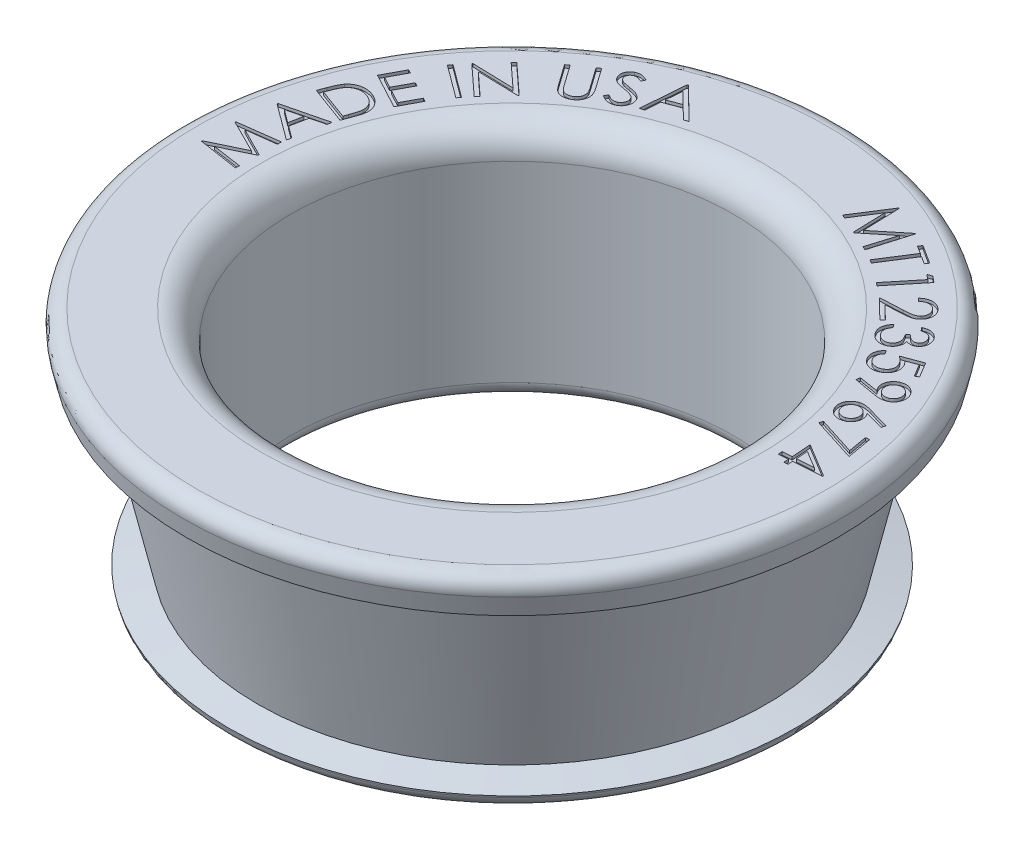
from build123d import *

# Parameters (mm, degrees)
CUT_EXTRUDE1_DEPTH = 0.2


with BuildPart() as part:
    # Sketch1 → Revolve1 (revolve)
    with BuildSketch(Plane.XY, mode=Mode.PRIVATE) as revolve1_sk:
        with BuildLine():
            Line((-15, 1), (-15, 14))
            ThreePointArc((-15, 14), (-15.585786438, 15.414213562), (-17, 16))
            Line((-17, 16), (-21.350008576, 16))
            ThreePointArc((-21.350008576, 16), (-22.130875294, 15.624697661), (-22.325619801, 14.780494335))
            Line((-22.325619801, 14.780494335), (-22.03526765, 13.49))
            Line((-22.03526765, 13.49), (-20.0840452, 13.92901133))
            Line((-20.0840452, 13.92901133), (-17.251383733, 1.33901133))
            Line((-17.251383733, 1.33901133), (-19.202606184, 0.9))
            Line((-19.202606184, 0.9), (-19.175718249, 0.780494335))
            ThreePointArc((-19.175718249, 0.780494335), (-18.824804685, 0.219133281), (-18.200107024, 0))
            Line((-18.200107024, 0), (-16, 0))
            ThreePointArc((-16, 0), (-15.292893219, 0.292893219), (-15, 1))
        make_face()
    revolve(revolve1_sk.sketch.rotate(Axis((0, 12.189542484, 0), (0, -1, 0)), 270), axis=Axis((0, 12.189542484, 0), (0, -1, 0)))

    # Sketch2 → Cut-Extrude1 (cut)
    # profile 1 of 19: a face of its own
    with BuildSketch(Plane(origin=(0, 16, 0), x_dir=(1, 0, 0), z_dir=(0, 1, 0))):
        Polygon((20.43086948, 0.684459038), (20.43472565, 0.628820016), (18.528675971, 0.495506714), (18.55181299, 0.164426987), (18.289593439, 0.1462479), (18.26645642, 0.477327628), (17.630739272, 0.432706234), (17.611458423, 0.705943413), (18.24717557, 0.750564807), (18.155729256, 2.057255512), align=None)
        Polygon((18.509395121, 0.768743894), (19.649168759, 0.848621698), (18.453205218, 1.573581634), align=None, mode=Mode.SUBTRACT)
    # profile 2 of 19: a face of its own
    with BuildSketch(Plane(origin=(0, 16, 0), x_dir=(1, 0, 0), z_dir=(0, 1, 0))):
        Polygon((19.866632365, 4.389117563), (20.163557446, 2.686343124), (17.160702878, 3.642673252), (17.23562275, 3.882857547), (19.836884769, 3.058738957), (19.612676035, 4.34504705), align=None)
    # profile 3 of 19: a face of its own
    with BuildSketch(Plane(origin=(0, 16, 0), x_dir=(1, 0, 0), z_dir=(0, 1, 0))):
        with BuildLine():
            Line((19.613202182, 5.734211606), (19.54213848, 5.474746462))
            Line((19.54213848, 5.474746462), (18.248668929, 5.835573785))
            add(Edge.make_bspline(
                [(18.248668929, 5.835573785), (18.263570366, 5.814895354), (18.292624338, 5.774577729), (18.32866575, 5.711118781), (18.359750467, 5.648742646), (18.374693, 5.605847669), (18.38198223, 5.584922744)],
                knots=[0, 0, 0, 0, 1.071951422, 2.090029772, 3.068282894, 4, 4, 4, 4], degree=3))
            add(Edge.make_bspline(
                [(18.38198223, 5.584922744), (18.389464761, 5.559339181), (18.404223048, 5.508879037), (18.417377424, 5.431878972), (18.422518818, 5.355620201), (18.419049881, 5.280094221), (18.407946789, 5.205352865), (18.389180761, 5.131071797), (18.361937108, 5.05771905), (18.327211748, 4.985940226), (18.286552719, 4.917048165), (18.239353341, 4.853289033), (18.186963618, 4.795341807), (18.129156403, 4.742909009), (18.065545548, 4.6968445), (17.996967165, 4.655737521), (17.922711385, 4.62080632), (17.870395274, 4.602601047), (17.843771092, 4.593336205)],
                knots=[0, 0, 0, 0, 1.017059747, 2.006013811, 2.975592457, 3.930021102, 4.886841578, 5.856090637, 6.849829531, 7.868965355, 8.897009229, 9.899612174, 10.892361288, 11.875207792, 12.873659358, 13.886068779, 14.924199685, 16, 16, 16, 16], degree=3))
            add(Edge.make_bspline(
                [(17.843771092, 4.593336205), (17.806717428, 4.582763755), (17.733848827, 4.561972298), (17.621961777, 4.548755719), (17.511437737, 4.548930149), (17.402721791, 4.564305459), (17.297704048, 4.594849431), (17.197722133, 4.639175203), (17.103626435, 4.697848622), (17.016764777, 4.769703973), (16.938842115, 4.852465262), (16.872326393, 4.944108446), (16.817105627, 5.043455997), (16.791368627, 5.114790447), (16.778366445, 5.150828192)],
                knots=[0, 0, 0, 0, 1.033318554, 2.032092631, 3.013380056, 3.99455597, 4.969915763, 5.941216094, 6.922305269, 7.938169325, 8.960273311, 9.966312265, 10.97259288, 12, 12, 12, 12], degree=3))
            add(Edge.make_bspline(
                [(16.778366445, 5.150828192), (16.768114542, 5.186412655), (16.747812576, 5.256880997), (16.736316196, 5.365906416), (16.736004003, 5.474743336), (16.752077265, 5.582635523), (16.780443877, 5.687917692), (16.825064135, 5.787104607), (16.881118599, 5.880916186), (16.952240187, 5.965499174), (17.03243215, 6.042087929), (17.122063962, 6.106591154), (17.218281638, 6.160984489), (17.287681654, 6.185636799), (17.322637278, 6.198053753)],
                knots=[0, 0, 0, 0, 1.012525083, 2.005115625, 2.990954643, 3.986789474, 4.983766827, 5.967872166, 6.956414768, 7.967489671, 8.985061678, 9.986090772, 10.985627698, 12, 12, 12, 12], degree=3))
            add(Edge.make_bspline(
                [(17.322637278, 6.198053753), (17.349859975, 6.205989988), (17.405337494, 6.222163351), (17.492821334, 6.235636229), (17.584700364, 6.24300876), (17.664456345, 6.242381671), (17.731648457, 6.237886113), (17.785895097, 6.232517684), (17.843400551, 6.224113732), (17.903959812, 6.21291902), (17.967867566, 6.199655053), (18.035162654, 6.184330357), (18.105607706, 6.165988679), (18.153570732, 6.152588711), (18.178156108, 6.145720019)],
                knots=[0, 0, 0, 0, 1.172219583, 2.388882806, 3.654047744, 4.983756441, 5.684276915, 6.440327581, 7.238718475, 8.088224331, 8.988283702, 9.939366117, 10.9437393, 12, 12, 12, 12], degree=3))
            Line((18.178156108, 6.145720019), (19.613202182, 5.734211606))
        make_face()
        with BuildLine():
            add(Edge.make_bspline(
                [(18.133534714, 5.573905115), (18.127107604, 5.592413442), (18.11445293, 5.628855458), (18.089385249, 5.680324322), (18.059912501, 5.728000262), (18.026580347, 5.772350082), (17.987715274, 5.811920316), (17.946208039, 5.849548898), (17.898750665, 5.881530539), (17.848616968, 5.910912044), (17.795660272, 5.934648158), (17.741750048, 5.953772025), (17.687320534, 5.967077709), (17.632084189, 5.974226569), (17.576538721, 5.975855737), (17.520239835, 5.971990838), (17.463560598, 5.962142713), (17.426296852, 5.951251686), (17.407473015, 5.945750067)],
                knots=[0, 0, 0, 0, 1.035921378, 2.039679938, 3.021138949, 3.998550293, 4.967425976, 5.951765989, 6.957028026, 7.988566464, 9.023393848, 10.022014201, 11.011709645, 11.981802356, 12.963501774, 13.947122328, 14.962985781, 16, 16, 16, 16], degree=3))
            add(Edge.make_bspline(
                [(17.407473015, 5.945750067), (17.388964281, 5.939323229), (17.352521464, 5.92666909), (17.301058427, 5.901597522), (17.253580189, 5.872274491), (17.209389369, 5.838994001), (17.169236176, 5.800676879), (17.132246536, 5.758460058), (17.099463366, 5.711404442), (17.07066079, 5.660897276), (17.046696801, 5.607896386), (17.027614419, 5.553959919), (17.014299573, 5.499537518), (17.007170569, 5.44448074), (17.00554348, 5.389125354), (17.00928798, 5.333354026), (17.019390876, 5.277090421), (17.030144661, 5.240167946), (17.035628063, 5.221341013)],
                knots=[0, 0, 0, 0, 1.037714762, 2.043211024, 3.026369134, 3.991834007, 4.969436824, 5.962802245, 6.961824933, 8.00359355, 9.040212423, 10.040561584, 11.031970384, 12.003742517, 12.977413451, 13.962736845, 14.961190506, 16, 16, 16, 16], degree=3))
            add(Edge.make_bspline(
                [(17.035628063, 5.221341013), (17.04205508, 5.202832495), (17.054709571, 5.166390103), (17.079778586, 5.114923975), (17.109110991, 5.067457085), (17.142357071, 5.023224613), (17.180708565, 4.983328777), (17.222428168, 4.945719871), (17.269855462, 4.913713791), (17.319992674, 4.884317257), (17.372966318, 4.860666205), (17.426767797, 4.841243187), (17.481430783, 4.829079347), (17.536276529, 4.820857979), (17.591749276, 4.819231975), (17.647378042, 4.824074139), (17.703804891, 4.833027582), (17.740672126, 4.843931544), (17.759486237, 4.849496061)],
                knots=[0, 0, 0, 0, 1.038341636, 2.044445311, 3.028197338, 3.99424544, 4.972438819, 5.959078579, 6.966689243, 8.0006377, 9.037882786, 10.038836249, 11.028594878, 12.002269794, 12.976528915, 13.963168675, 14.96056297, 16, 16, 16, 16], degree=3))
            add(Edge.make_bspline(
                [(17.759486237, 4.849496061), (17.777987623, 4.855941046), (17.814572325, 4.868685381), (17.866421025, 4.893663161), (17.914638594, 4.922920145), (17.958988315, 4.956686621), (17.999225745, 4.99490273), (18.036095604, 5.037224225), (18.068886268, 5.084057505), (18.098101802, 5.134449), (18.121880061, 5.187363492), (18.141053333, 5.241275198), (18.154131873, 5.295762914), (18.162123145, 5.350707308), (18.163812285, 5.406164923), (18.158952982, 5.461797797), (18.150004156, 5.518223539), (18.139099556, 5.555090927), (18.133534714, 5.573905115)],
                knots=[0, 0, 0, 0, 1.036259662, 2.049103211, 3.039169544, 4.016900064, 4.993132071, 5.97139377, 6.982557334, 8.014432625, 9.049597935, 10.04854439, 11.038563022, 12.010285626, 12.982591265, 13.967252717, 14.962647141, 16, 16, 16, 16], degree=3))
        make_face(mode=Mode.SUBTRACT)
    # profile 4 of 19: a face of its own
    with BuildSketch(Plane(origin=(0, 16, 0), x_dir=(1, 0, 0), z_dir=(0, 1, 0))):
        with BuildLine():
            Line((15.886447715, 7.438916574), (15.927763821, 7.704441414))
            Line((15.927763821, 7.704441414), (17.254837138, 7.484088849))
            add(Edge.make_bspline(
                [(17.254837138, 7.484088849), (17.2379649, 7.503463471), (17.205184856, 7.541105246), (17.162962006, 7.600697944), (17.125719634, 7.659468848), (17.10626522, 7.700375912), (17.096734173, 7.720416974)],
                knots=[0, 0, 0, 0, 1.079446535, 2.097191025, 3.067781697, 4, 4, 4, 4], degree=3))
            add(Edge.make_bspline(
                [(17.096734173, 7.720416974), (17.086463151, 7.745198073), (17.066255583, 7.793953274), (17.04559552, 7.869460064), (17.032152445, 7.944689161), (17.026461979, 8.020200997), (17.029258947, 8.095948685), (17.040511351, 8.171775451), (17.059506719, 8.247718951), (17.085668927, 8.32302489), (17.118942424, 8.3960704), (17.159469483, 8.464419082), (17.205298655, 8.52826153), (17.257225284, 8.586908361), (17.315545009, 8.640078102), (17.379762616, 8.687853116), (17.449395386, 8.731659786), (17.499697796, 8.755134524), (17.52531991, 8.767091654)],
                knots=[0, 0, 0, 0, 1.020953732, 2.008660133, 2.974629625, 3.928468592, 4.887372089, 5.855794922, 6.843129749, 7.865113259, 8.888579743, 9.895054551, 10.887061043, 11.878031291, 12.873164625, 13.887387248, 14.923916253, 16, 16, 16, 16], degree=3))
            add(Edge.make_bspline(
                [(17.52531991, 8.767091654), (17.561168874, 8.781630853), (17.631519142, 8.810162683), (17.741148737, 8.83611936), (17.850848537, 8.8465514), (17.96019228, 8.842894308), (18.067698778, 8.824096718), (18.171983979, 8.79077714), (18.27183455, 8.742105946), (18.366332438, 8.680011517), (18.453817993, 8.607049152), (18.529556172, 8.522738116), (18.595313437, 8.430512197), (18.628538309, 8.362715199), (18.645261817, 8.328590051)],
                knots=[0, 0, 0, 0, 1.038237026, 2.037443937, 3.013882615, 3.991355268, 4.967931042, 5.936849831, 6.923197063, 7.942661205, 8.968539792, 9.97444765, 10.980452295, 12, 12, 12, 12], degree=3))
            add(Edge.make_bspline(
                [(18.645261817, 8.328590051), (18.659272735, 8.294024304), (18.687040248, 8.225520235), (18.711321953, 8.117780643), (18.722107379, 8.008578463), (18.718131076, 7.89892078), (18.700250537, 7.790795659), (18.667243342, 7.686934592), (18.620720765, 7.587644687), (18.559350041, 7.49549787), (18.487838633, 7.410663638), (18.405961598, 7.337117783), (18.316240678, 7.27351263), (18.250414062, 7.241376377), (18.217226962, 7.225174587)],
                knots=[0, 0, 0, 0, 1.017701609, 2.016930239, 3.004960264, 4.00906468, 5.006326224, 5.990181482, 6.977740019, 7.992233138, 9.006664218, 10.001309583, 10.992341663, 12, 12, 12, 12], degree=3))
            add(Edge.make_bspline(
                [(18.217226962, 7.225174587), (18.190784352, 7.214377042), (18.136931834, 7.192386967), (18.051028079, 7.168530297), (17.959977583, 7.15152536), (17.880251156, 7.143423002), (17.812904279, 7.140431258), (17.758330475, 7.140711508), (17.700269852, 7.142220771), (17.638724827, 7.146175809), (17.573520361, 7.152316221), (17.504818829, 7.160568515), (17.432683486, 7.171170941), (17.383548733, 7.179199031), (17.358402843, 7.183307599)],
                knots=[0, 0, 0, 0, 1.177368547, 2.397806446, 3.669468466, 4.994467892, 5.699549295, 6.449426534, 7.245075434, 8.095076712, 8.992744928, 9.946352323, 10.948996452, 12, 12, 12, 12], degree=3))
            Line((17.358402843, 7.183307599), (15.886447715, 7.438916574))
        make_face()
        with BuildLine():
            add(Edge.make_bspline(
                [(17.342427282, 7.760080436), (17.350885219, 7.742261162), (17.367520756, 7.70721323), (17.398325291, 7.658519237), (17.432365933, 7.613669838), (17.470600482, 7.573226524), (17.512912832, 7.537072927), (17.559136485, 7.505270373), (17.609315656, 7.477416751), (17.662671665, 7.454182869), (17.717865898, 7.435293227), (17.773678239, 7.422794617), (17.829353464, 7.415218545), (17.884946159, 7.414366613), (17.940322778, 7.418662835), (17.99540531, 7.428946124), (18.050633567, 7.443918474), (18.086264157, 7.458885868), (18.104296272, 7.466460644)],
                knots=[0, 0, 0, 0, 1.041528426, 2.048535627, 3.038377746, 4.013121523, 4.983556857, 5.974112206, 6.973186582, 8.01168184, 9.045815563, 10.050997669, 11.0295499, 12.009832722, 12.983319824, 13.959752723, 14.967461003, 16, 16, 16, 16], degree=3))
            add(Edge.make_bspline(
                [(18.104296272, 7.466460644), (18.121884258, 7.474997836), (18.156533026, 7.491816314), (18.205430727, 7.521533185), (18.249625195, 7.556074827), (18.290037199, 7.594072753), (18.326264661, 7.636231947), (18.357369723, 7.682800614), (18.385344727, 7.732772614), (18.408532648, 7.786160919), (18.427427178, 7.841347177), (18.439991313, 7.897337025), (18.447464362, 7.953206577), (18.448390118, 8.008984351), (18.443954645, 8.064515152), (18.434038386, 8.119925534), (18.417984887, 8.175262321), (18.403211545, 8.211192896), (18.395712538, 8.229431398)],
                knots=[0, 0, 0, 0, 1.032605273, 2.034257941, 3.016171675, 3.990676813, 4.960874564, 5.945707462, 6.944537243, 7.982778255, 9.016658799, 10.021594814, 11.009528805, 11.989571632, 12.962820403, 13.948560784, 14.95868137, 16, 16, 16, 16], degree=3))
            add(Edge.make_bspline(
                [(18.395712538, 8.229431398), (18.387221573, 8.24704806), (18.370452158, 8.281840467), (18.340006839, 8.330401523), (18.305584785, 8.374783448), (18.267539648, 8.415166227), (18.225393005, 8.45140127), (18.178821115, 8.482505103), (18.128849263, 8.510477236), (18.075463781, 8.533678409), (18.020435782, 8.552465277), (17.964669686, 8.565195931), (17.909144751, 8.572571533), (17.853562998, 8.573499822), (17.798367438, 8.569190584), (17.743285527, 8.558914661), (17.6880571, 8.5439403), (17.652426533, 8.528973182), (17.634394429, 8.521398545)],
                knots=[0, 0, 0, 0, 1.034887623, 2.043873513, 3.027957555, 4.004616624, 4.976958787, 5.963968446, 6.965005923, 8.005541742, 9.041707455, 10.039386768, 11.029504373, 12.001992362, 12.977392288, 13.9557438, 14.965432147, 16, 16, 16, 16], degree=3))
            add(Edge.make_bspline(
                [(17.634394429, 8.521398545), (17.616806682, 8.51286119), (17.582158383, 8.49604239), (17.533257267, 8.466327862), (17.48907542, 8.431777566), (17.448616847, 8.393811565), (17.412495641, 8.351454211), (17.380684229, 8.305242856), (17.352833057, 8.255060318), (17.329598412, 8.201705224), (17.310709277, 8.146510831), (17.298209448, 8.090698222), (17.290637624, 8.035024187), (17.289769979, 7.979427017), (17.294124529, 7.924067032), (17.304196538, 7.868872069), (17.32004577, 7.813841024), (17.334912995, 7.77812982), (17.342427282, 7.760080436)],
                knots=[0, 0, 0, 0, 1.03407368, 2.037150739, 3.020460795, 3.996351719, 4.967929131, 5.959650235, 6.959900392, 7.999617825, 9.03496859, 10.041333666, 11.021037526, 12.002474014, 12.977106785, 13.954688819, 14.966245838, 16, 16, 16, 16], degree=3))
        make_face(mode=Mode.SUBTRACT)
    # profile 5 of 19: a face of its own
    with BuildSketch(Plane(origin=(0, 16, 0), x_dir=(1, 0, 0), z_dir=(0, 1, 0))):
        with BuildLine():
            Line((17.883266149, 9.751450901), (17.659057415, 9.617586719))
            Line((17.659057415, 9.617586719), (17.15720445, 10.456579106))
            Line((17.15720445, 10.456579106), (16.445465668, 10.188850741))
            add(Edge.make_bspline(
                [(16.445465668, 10.188850741), (16.467220404, 10.167999014), (16.509161399, 10.127798932), (16.565714991, 10.06509552), (16.614685353, 10.003079632), (16.642091942, 9.960096884), (16.655351485, 9.939301462)],
                knots=[0, 0, 0, 0, 1.105223162, 2.130761699, 3.095646451, 4, 4, 4, 4], degree=3))
            add(Edge.make_bspline(
                [(16.655351485, 9.939301462), (16.670297009, 9.912538322), (16.699600977, 9.860063335), (16.735416735, 9.778612472), (16.76096332, 9.696247022), (16.779327711, 9.613575043), (16.787311179, 9.530186654), (16.786833677, 9.446370796), (16.777290063, 9.362198703), (16.759188648, 9.27842058), (16.732791756, 9.196496492), (16.698671741, 9.117940032), (16.656444006, 9.043934822), (16.607277773, 8.973798716), (16.549371174, 8.908691629), (16.484204923, 8.847622742), (16.41173645, 8.790105204), (16.358593023, 8.756967957), (16.331433216, 8.740032632)],
                knots=[0, 0, 0, 0, 1.056230551, 2.0709709, 3.059819983, 4.024368298, 4.984775428, 5.940499657, 6.908530257, 7.899160177, 8.889931616, 9.870604386, 10.845623872, 11.821977694, 12.817488488, 13.842832062, 14.897544494, 16, 16, 16, 16], degree=3))
            add(Edge.make_bspline(
                [(16.331433216, 8.740032632), (16.312091876, 8.728968436), (16.273783425, 8.707054121), (16.214513695, 8.678423526), (16.154501664, 8.653363317), (16.093244768, 8.63324075), (16.031536251, 8.616431834), (15.968895766, 8.604409715), (15.905430641, 8.596153151), (15.841409326, 8.591627981), (15.777733795, 8.591751596), (15.715190315, 8.595614173), (15.654012014, 8.603081342), (15.594439066, 8.615425616), (15.536172213, 8.631299261), (15.479414806, 8.651919224), (15.423786534, 8.676077979), (15.369527458, 8.704194125), (15.317538335, 8.736611404), (15.267558565, 8.772784417), (15.219561738, 8.812372917), (15.17397061, 8.85604166), (15.130180803, 8.902972351), (15.088896458, 8.953845368), (15.049574756, 9.008401615), (15.025789381, 9.047084464), (15.013724883, 9.066705308)],
                knots=[0, 0, 0, 0, 1.054064986, 2.087735186, 3.11234581, 4.128967723, 5.136414227, 6.136678694, 7.144349983, 8.163308407, 9.17120443, 10.154916219, 11.127009337, 12.08466666, 13.031143332, 13.982076284, 14.93929993, 15.89920135, 16.870867234, 17.835476005, 18.816690425, 19.812302386, 20.820572856, 21.851903273, 22.910435187, 24, 24, 24, 24], degree=3))
            add(Edge.make_bspline(
                [(15.013724883, 9.066705308), (15.000300916, 9.090373194), (14.973773738, 9.13714344), (14.94129195, 9.209719296), (14.916530163, 9.283042073), (14.897775595, 9.356440678), (14.887746393, 9.430717139), (14.883349017, 9.505206289), (14.887805186, 9.580244678), (14.897875885, 9.65535616), (14.915599693, 9.729229541), (14.939291311, 9.800592796), (14.969127229, 9.868963732), (15.00589969, 9.933860116), (15.047631351, 9.996616916), (15.096485241, 10.055713727), (15.15175383, 10.111405284), (15.192132554, 10.145621456), (15.212593072, 10.162959315)],
                knots=[0, 0, 0, 0, 1.067413164, 2.109321305, 3.114291042, 4.101772644, 5.077057584, 6.051197089, 7.025336594, 8.022030563, 9.021819742, 10.001699534, 10.969716098, 11.944015512, 12.925351587, 13.923685392, 14.947899562, 16, 16, 16, 16], degree=3))
            Line((15.212593072, 10.162959315), (15.357474883, 9.921122376))
            add(Edge.make_bspline(
                [(15.357474883, 9.921122376), (15.338485968, 9.903366158), (15.301944736, 9.869197062), (15.256042303, 9.812782499), (15.218456533, 9.75603419), (15.190526496, 9.697343594), (15.171136564, 9.636892932), (15.158729753, 9.574223297), (15.154865983, 9.50855393), (15.156775207, 9.440987165), (15.166479027, 9.373055723), (15.184577048, 9.307327835), (15.208441082, 9.243533105), (15.230608882, 9.20398843), (15.241789787, 9.184043049)],
                knots=[0, 0, 0, 0, 1.148740579, 2.210573737, 3.208606875, 4.15321981, 5.075355568, 6.01042175, 6.971067052, 7.978770579, 8.99650644, 9.997410958, 10.989942328, 12, 12, 12, 12], degree=3))
            add(Edge.make_bspline(
                [(15.241789787, 9.184043049), (15.253684949, 9.165205895), (15.277153502, 9.128041146), (15.31899254, 9.07799559), (15.364287715, 9.032591303), (15.414868215, 8.993703415), (15.468928027, 8.959295143), (15.527388759, 8.930257693), (15.590381008, 8.907585034), (15.656565711, 8.889145454), (15.724905119, 8.877881528), (15.793503549, 8.872803205), (15.861799888, 8.874365772), (15.929778783, 8.883154359), (15.997263186, 8.899673431), (16.064744604, 8.921505213), (16.13178909, 8.95076717), (16.174650117, 8.9753938), (16.196467271, 8.987929267)],
                knots=[0, 0, 0, 0, 0.983962148, 1.941307442, 2.87703253, 3.814059754, 4.75550777, 5.706740854, 6.693044578, 7.711241678, 8.740255896, 9.749578728, 10.74843211, 11.755401444, 12.773436706, 13.815751248, 14.888172002, 16, 16, 16, 16], degree=3))
            add(Edge.make_bspline(
                [(16.196467271, 8.987929267), (16.215608733, 9.000089177), (16.253086209, 9.023897323), (16.304372508, 9.064455808), (16.350643801, 9.107277435), (16.390453044, 9.154187134), (16.425338803, 9.203571475), (16.45422148, 9.256228732), (16.476765483, 9.31201196), (16.494436451, 9.370028436), (16.506048998, 9.430019469), (16.511026215, 9.490795004), (16.509327967, 9.551929676), (16.500975988, 9.6134179), (16.485835931, 9.675119057), (16.464883384, 9.737419129), (16.436492038, 9.799688835), (16.413635317, 9.840304714), (16.401946037, 9.861076302)],
                knots=[0, 0, 0, 0, 1.076867555, 2.108421845, 3.102200765, 4.067496262, 5.02602517, 5.970956099, 6.913951519, 7.880035334, 8.848558858, 9.811525056, 10.771641065, 11.74892827, 12.754132062, 13.786055278, 14.86775447, 16, 16, 16, 16], degree=3))
            add(Edge.make_bspline(
                [(16.401946037, 9.861076302), (16.390791899, 9.878678077), (16.367976409, 9.914682035), (16.328190452, 9.967340787), (16.283219134, 10.020566165), (16.232351522, 10.07397918), (16.175879526, 10.127633325), (16.113545117, 10.181187193), (16.046280752, 10.236199814), (15.998491586, 10.271503535), (15.973911181, 10.289662039)],
                knots=[0, 0, 0, 0, 0.82011155, 1.6775162, 2.595760191, 3.562254399, 4.579851, 5.661191924, 6.797031754, 8, 8, 8, 8], degree=3))
            Line((15.973911181, 10.289662039), (17.272889546, 10.771683273))
            Line((17.272889546, 10.771683273), (17.883266149, 9.751450901))
        make_face()
    # profile 6 of 19: a face of its own
    with BuildSketch(Plane(origin=(0, 16, 0), x_dir=(1, 0, 0), z_dir=(0, 1, 0))):
        with BuildLine():
            Line((15.22922776, 12.504583298), (15.059556286, 12.724384981))
            add(Edge.make_bspline(
                [(15.059556286, 12.724384981), (15.085316396, 12.735721759), (15.135694487, 12.757892675), (15.212148766, 12.78516647), (15.287492617, 12.805597277), (15.361753776, 12.819391141), (15.434685573, 12.827438826), (15.506586614, 12.828351961), (15.577408274, 12.823612267), (15.646746987, 12.812006298), (15.71386732, 12.79415971), (15.778555981, 12.771818948), (15.839981831, 12.74357541), (15.898206218, 12.709720089), (15.953298064, 12.670363577), (16.005909291, 12.626277627), (16.05526647, 12.576409906), (16.085047653, 12.539734442), (16.10017127, 12.521109741)],
                knots=[0, 0, 0, 0, 1.170621759, 2.289341555, 3.37343437, 4.414775063, 5.428829454, 6.422066798, 7.402322022, 8.37816166, 9.341693541, 10.288792222, 11.22198596, 12.149660019, 13.086567386, 14.035359102, 15.002307077, 16, 16, 16, 16], degree=3))
            add(Edge.make_bspline(
                [(16.10017127, 12.521109741), (16.120758716, 12.492765085), (16.161448253, 12.436744008), (16.208951963, 12.344668246), (16.24437305, 12.248185461), (16.267783227, 12.14845672), (16.27972045, 12.048059937), (16.278210395, 11.949276415), (16.263284569, 11.853366869), (16.235034417, 11.762086614), (16.196613165, 11.676513151), (16.148613212, 11.598818405), (16.090811611, 11.529707174), (16.04532077, 11.491434032), (16.022496991, 11.472231535)],
                knots=[0, 0, 0, 0, 1.079583299, 2.133715055, 3.184049225, 4.243526234, 5.28708527, 6.295656947, 7.28202626, 8.271271126, 9.23479344, 10.168610749, 11.081150791, 12, 12, 12, 12], degree=3))
            add(Edge.make_bspline(
                [(16.022496991, 11.472231535), (15.999246351, 11.455549799), (15.953675064, 11.422853573), (15.878608853, 11.386429365), (15.800875561, 11.360540618), (15.719708245, 11.346835013), (15.635516989, 11.344705156), (15.548636279, 11.354673583), (15.458482561, 11.374952321), (15.399225238, 11.396957108), (15.368600757, 11.408329292)],
                knots=[0, 0, 0, 0, 0.993167429, 1.946609529, 2.887231222, 3.83271326, 4.796884882, 5.804874094, 6.865547965, 8, 8, 8, 8], degree=3))
            add(Edge.make_bspline(
                [(15.368600757, 11.408329292), (15.376832613, 11.374882813), (15.393097326, 11.3087984), (15.401821452, 11.208001725), (15.399403388, 11.10827555), (15.386950899, 11.043536665), (15.380720148, 11.011143795)],
                knots=[0, 0, 0, 0, 1.028424054, 2.031986648, 3.01528113, 4, 4, 4, 4], degree=3))
            add(Edge.make_bspline(
                [(15.380720148, 11.011143795), (15.375028569, 10.988816027), (15.363839214, 10.944920771), (15.340863629, 10.881553139), (15.313498482, 10.821618781), (15.281291967, 10.765110856), (15.244831134, 10.711868883), (15.20346234, 10.662133196), (15.156810032, 10.616214989), (15.122943029, 10.588366459), (15.105830324, 10.574294837)],
                knots=[0, 0, 0, 0, 1.04933343, 2.062936215, 3.066265967, 4.047979045, 5.022679286, 6.00285813, 6.990861457, 8, 8, 8, 8], degree=3))
            add(Edge.make_bspline(
                [(15.105830324, 10.574294837), (15.074659271, 10.552012445), (15.01270031, 10.50772155), (14.908663032, 10.458504368), (14.798661442, 10.420931132), (14.68239529, 10.398971321), (14.56412891, 10.390864531), (14.44657703, 10.39919003), (14.331637303, 10.423662877), (14.220316244, 10.464033249), (14.114247058, 10.519369929), (14.015066214, 10.58881659), (13.923042641, 10.672009882), (13.869797304, 10.736458647), (13.842659251, 10.769306856)],
                knots=[0, 0, 0, 0, 0.967326136, 1.922762143, 2.897916062, 3.900711948, 4.905945992, 5.888327616, 6.871137262, 7.868628225, 8.873990995, 9.887919833, 10.923516197, 12, 12, 12, 12], degree=3))
            add(Edge.make_bspline(
                [(13.842659251, 10.769306856), (13.825498102, 10.792325526), (13.791835271, 10.837478308), (13.749884083, 10.909183896), (13.713120189, 10.9808384), (13.685561062, 11.054438167), (13.663328018, 11.128454435), (13.650028554, 11.203708563), (13.642386963, 11.279784616), (13.643042298, 11.356783783), (13.651599783, 11.434182531), (13.666649565, 11.511477138), (13.690948867, 11.58829641), (13.722909221, 11.664493635), (13.762459354, 11.740506618), (13.809389705, 11.816149878), (13.864609464, 11.891191702), (13.906216547, 11.939111104), (13.927494988, 11.963617753)],
                knots=[0, 0, 0, 0, 1.046164699, 2.052127569, 3.025355424, 3.979155154, 4.913650632, 5.839566384, 6.761040685, 7.698506168, 8.641313105, 9.597319676, 10.565188662, 11.573711097, 12.606938389, 13.686513166, 14.816850631, 16, 16, 16, 16], degree=3))
            Line((13.927494988, 11.963617753), (14.090555885, 11.752630173))
            add(Edge.make_bspline(
                [(14.090555885, 11.752630173), (14.077354663, 11.734936649), (14.051634959, 11.700464674), (14.016825188, 11.648197864), (13.987139037, 11.597002182), (13.961785263, 11.547165278), (13.942381987, 11.49829054), (13.926304085, 11.451034929), (13.915808137, 11.404837476), (13.912182969, 11.374213463), (13.910417664, 11.359300846)],
                knots=[0, 0, 0, 0, 1.208536834, 2.354570562, 3.435752511, 4.447386667, 5.412594331, 6.312330366, 7.178175274, 8, 8, 8, 8], degree=3))
            add(Edge.make_bspline(
                [(13.910417664, 11.359300846), (13.909666369, 11.340751468), (13.908161573, 11.303598261), (13.912829026, 11.248023263), (13.922821715, 11.192866259), (13.938401362, 11.138555605), (13.958671773, 11.084455608), (13.985839018, 11.031702869), (14.016660408, 10.978357503), (14.04189108, 10.944973262), (14.054748594, 10.927960702)],
                knots=[0, 0, 0, 0, 0.956791072, 1.916390735, 2.869424145, 3.843866249, 4.827151895, 5.843720866, 6.901163341, 8, 8, 8, 8], degree=3))
            add(Edge.make_bspline(
                [(14.054748594, 10.927960702), (14.069834881, 10.9091172), (14.099294747, 10.872320401), (14.148297555, 10.823220082), (14.198847896, 10.779834202), (14.252071137, 10.743489195), (14.307035439, 10.712663544), (14.364296975, 10.688429945), (14.423986821, 10.670635335), (14.485135703, 10.65926454), (14.546374849, 10.653955521), (14.60635043, 10.653546073), (14.664205407, 10.659990634), (14.720473885, 10.670635658), (14.774378625, 10.688091102), (14.82678632, 10.710131037), (14.877073584, 10.738211452), (14.908288425, 10.76107512), (14.924039459, 10.772612144)],
                knots=[0, 0, 0, 0, 1.174255564, 2.293036807, 3.371192855, 4.412555279, 5.424893408, 6.434306956, 7.432616995, 8.45121062, 9.456340586, 10.421732668, 11.36544471, 12.28579551, 13.204582269, 14.117742549, 15.05021141, 16, 16, 16, 16], degree=3))
            add(Edge.make_bspline(
                [(14.924039459, 10.772612144), (14.944046245, 10.789494375), (14.984010879, 10.823217539), (15.034119842, 10.883778609), (15.07487553, 10.951745259), (15.106305098, 11.025559097), (15.128813937, 11.103370005), (15.13843479, 11.18347149), (15.137458522, 11.264097572), (15.126837978, 11.331989027), (15.111356512, 11.387608936), (15.09608324, 11.433086857), (15.075038405, 11.481126984), (15.050650288, 11.532608253), (15.020931025, 11.587043281), (14.986823617, 11.644356586), (14.948966887, 11.705332074), (14.920913275, 11.745954007), (14.906411254, 11.76695309)],
                knots=[0, 0, 0, 0, 1.124437763, 2.246125028, 3.362458679, 4.523162054, 5.688560254, 6.834954948, 7.980505594, 9.148070436, 9.778555351, 10.463045364, 11.209881218, 12.03314667, 12.913269653, 13.87653484, 14.902296939, 16, 16, 16, 16], degree=3))
            Line((14.906411254, 11.76695309), (15.103626799, 11.918996359))
            add(Edge.make_bspline(
                [(15.103626799, 11.918996359), (15.123076069, 11.895525279), (15.161255081, 11.849451434), (15.224156426, 11.787123393), (15.291966532, 11.73441106), (15.361548881, 11.688932711), (15.432752927, 11.654863964), (15.501602488, 11.629629646), (15.568164983, 11.61680468), (15.631672911, 11.61394761), (15.691835417, 11.623127205), (15.748979922, 11.638425488), (15.802278773, 11.663933653), (15.834382026, 11.68625195), (15.850621991, 11.697542032)],
                knots=[0, 0, 0, 0, 1.265161036, 2.483517262, 3.667028433, 4.825925916, 5.927248791, 6.937521129, 7.861527016, 8.731159728, 9.562419002, 10.378186849, 11.179578806, 12, 12, 12, 12], degree=3))
            add(Edge.make_bspline(
                [(15.850621991, 11.697542032), (15.861833808, 11.706873878), (15.883933516, 11.725267961), (15.913453397, 11.756401569), (15.93860161, 11.790338008), (15.961301981, 11.825941705), (15.97798778, 11.865264183), (15.992033482, 11.906619411), (16.001730666, 11.950781193), (16.007875557, 11.996849478), (16.009403413, 12.043884022), (16.006880758, 12.090976114), (15.998881977, 12.137416623), (15.986864406, 12.183441279), (15.969668959, 12.22858709), (15.947715664, 12.272961957), (15.922232259, 12.317263768), (15.901420547, 12.34502969), (15.890836334, 12.359150606)],
                knots=[0, 0, 0, 0, 0.948564574, 1.869723848, 2.782477639, 3.694292705, 4.608921057, 5.553414197, 6.533068051, 7.545184008, 8.573250798, 9.590501041, 10.607891585, 11.633734624, 12.68105785, 13.744340692, 14.852839302, 16, 16, 16, 16], degree=3))
            add(Edge.make_bspline(
                [(15.890836334, 12.359150606), (15.872583643, 12.380901092), (15.83693664, 12.423379191), (15.773070564, 12.475452789), (15.702761863, 12.514223708), (15.639684828, 12.536857565), (15.586119804, 12.547686876), (15.543000673, 12.552772354), (15.497123828, 12.553465506), (15.448462818, 12.551632728), (15.397449167, 12.544340485), (15.343497801, 12.535180133), (15.286999327, 12.522006978), (15.248815575, 12.510490907), (15.22922776, 12.504583298)],
                knots=[0, 0, 0, 0, 1.399838653, 2.733846269, 4.040800811, 5.348510018, 6.024254412, 6.736198773, 7.489005781, 8.287754867, 9.138007628, 10.030944185, 10.989897596, 12, 12, 12, 12], degree=3))
        make_face()
    # profile 7 of 19: a face of its own
    with BuildSketch(Plane(origin=(0, 16, 0), x_dir=(1, 0, 0), z_dir=(0, 1, 0))):
        with BuildLine():
            Line((13.409611884, 14.157364559), (13.222863086, 14.340257188))
            add(Edge.make_bspline(
                [(13.222863086, 14.340257188), (13.24705242, 14.362788738), (13.294586896, 14.407065502), (13.371773881, 14.463858757), (13.450067436, 14.514062758), (13.531999506, 14.55326245), (13.615753989, 14.585125539), (13.701849911, 14.608588249), (13.79056925, 14.621999306), (13.880555456, 14.627681505), (13.970217397, 14.624319232), (14.05784789, 14.612764935), (14.142673509, 14.59300194), (14.224410459, 14.564176786), (14.303130136, 14.526910545), (14.378962147, 14.48161843), (14.45154027, 14.427318586), (14.496318169, 14.385672411), (14.519087044, 14.36449597)],
                knots=[0, 0, 0, 0, 1.097684638, 2.157060765, 3.17973517, 4.184093402, 5.169020387, 6.154892147, 7.143121891, 8.145773102, 9.147235104, 10.119892229, 11.079055637, 12.036334196, 12.994487631, 13.968827886, 14.967180126, 16, 16, 16, 16], degree=3))
            add(Edge.make_bspline(
                [(14.519087044, 14.36449597), (14.540636504, 14.34248269), (14.582782103, 14.299429969), (14.637457489, 14.229558731), (14.683542991, 14.157589928), (14.721230346, 14.083419261), (14.750871268, 14.006936839), (14.771199215, 13.927971929), (14.782796962, 13.846680538), (14.785857456, 13.764188193), (14.781523862, 13.682139537), (14.769943124, 13.602280511), (14.751366794, 13.525643189), (14.725208549, 13.452214305), (14.691808877, 13.382133745), (14.652399809, 13.314471092), (14.604480447, 13.250874084), (14.568272191, 13.211571962), (14.549936403, 13.191669447)],
                knots=[0, 0, 0, 0, 1.127792723, 2.205693365, 3.24320908, 4.25401682, 5.248419127, 6.242024792, 7.234240495, 8.250784342, 9.261233894, 10.240134976, 11.202721451, 12.145261741, 13.090103602, 14.043028417, 15.008993551, 16, 16, 16, 16], degree=3))
            add(Edge.make_bspline(
                [(14.549936403, 13.191669447), (14.522315865, 13.165359106), (14.467437858, 13.113084272), (14.373685815, 13.048812139), (14.273329559, 12.995724005), (14.182664751, 12.962466428), (14.103848985, 12.941779725), (14.036676514, 12.926596184), (13.961562535, 12.91398224), (13.878603041, 12.901549572), (13.78796575, 12.891555463), (13.689383884, 12.881901403), (13.583002993, 12.874510192), (13.509326292, 12.870415063), (13.471310602, 12.868302059)],
                knots=[0, 0, 0, 0, 1.186743773, 2.357887887, 3.527256321, 4.716369176, 5.356071332, 6.065278146, 6.86092497, 7.728183885, 8.678307981, 9.701194984, 10.813863032, 12, 12, 12, 12], degree=3))
            Line((13.471310602, 12.868302059), (12.47421525, 12.819824495))
            Line((12.47421525, 12.819824495), (13.374355474, 11.938414239))
            Line((13.374355474, 11.938414239), (13.189810201, 11.750012797))
            Line((13.189810201, 11.750012797), (11.865491291, 13.046787636))
            Line((11.865491291, 13.046787636), (13.398594256, 13.12225839))
            add(Edge.make_bspline(
                [(13.398594256, 13.12225839), (13.435877832, 13.123963544), (13.507535339, 13.127240781), (13.610353087, 13.13403561), (13.70441293, 13.140975636), (13.789642302, 13.149180454), (13.866273774, 13.158348085), (13.934018362, 13.168907885), (13.993121139, 13.179557899), (14.059516511, 13.195461285), (14.134111671, 13.220713101), (14.215458216, 13.26204972), (14.290664608, 13.312190457), (14.334166738, 13.353335966), (14.356026147, 13.374011194)],
                knots=[0, 0, 0, 0, 1.323243412, 2.54321964, 3.653243836, 4.667092822, 5.578801727, 6.389096633, 7.097789806, 7.707317384, 8.808831704, 9.880306154, 10.934873908, 12, 12, 12, 12], degree=3))
            add(Edge.make_bspline(
                [(14.356026147, 13.374011194), (14.368760367, 13.387937642), (14.393816688, 13.415339837), (14.426763806, 13.459714801), (14.453817576, 13.506977671), (14.475897064, 13.556417706), (14.492509088, 13.60835226), (14.504207081, 13.662392023), (14.509970842, 13.718895118), (14.511256018, 13.776784789), (14.506674065, 13.834842192), (14.497581356, 13.89173241), (14.482531508, 13.946733571), (14.462035466, 13.999602368), (14.436669958, 14.050682391), (14.405543803, 14.099330993), (14.368982856, 14.145998498), (14.341061891, 14.174690297), (14.326829432, 14.189315681)],
                knots=[0, 0, 0, 0, 0.99823837, 1.964170784, 2.917557768, 3.874602325, 4.824168502, 5.798083963, 6.794997154, 7.825215894, 8.858180669, 9.872605081, 10.86975504, 11.869505751, 12.869020309, 13.882606623, 14.920677893, 16, 16, 16, 16], degree=3))
            add(Edge.make_bspline(
                [(14.326829432, 14.189315681), (14.311324623, 14.203973595), (14.280836183, 14.232796712), (14.230936086, 14.269591487), (14.179326832, 14.300851759), (14.125725928, 14.32609599), (14.070573216, 14.346404608), (14.013137303, 14.359404719), (13.954118962, 14.367110367), (13.893433176, 14.369342923), (13.831939084, 14.365608566), (13.770435422, 14.355064262), (13.709481566, 14.337645614), (13.648733867, 14.314282735), (13.587733178, 14.285254011), (13.527854567, 14.248211751), (13.46757328, 14.206065267), (13.429207026, 14.17382892), (13.409611884, 14.157364559)],
                knots=[0, 0, 0, 0, 1.002295113, 1.970899169, 2.908062872, 3.834831094, 4.752345746, 5.665341296, 6.596921847, 7.547155263, 8.515913188, 9.488088395, 10.474683329, 11.491154209, 12.545237488, 13.645265037, 14.797345008, 16, 16, 16, 16], degree=3))
        make_face()
    # profile 8 of 19: a face of its own
    with BuildSketch(Plane(origin=(0, 16, 0), x_dir=(1, 0, 0), z_dir=(0, 1, 0))):
        Polygon((12.409915094, 16.123602181), (12.828034085, 15.782606588), (11.093308524, 13.655653463), (10.881770062, 13.828079345), (12.446273267, 15.746799297), (12.112439133, 16.018934713), align=None)
    # profile 9 of 19: a face of its own
    with BuildSketch(Plane(origin=(0, 16, 0), x_dir=(1, 0, 0), z_dir=(0, 1, 0))):
        Polygon((10.137878032, 17.358412667), (10.280005436, 17.58207052), (11.544278273, 16.776681898), (11.402150869, 16.553024046), (10.888178513, 16.880798485), (9.56275784, 14.800119398), (9.327531478, 14.949959142), (10.652952151, 17.030638228), align=None)
    # profile 10 of 19: a face of its own
    with BuildSketch(Plane(origin=(0, 16, 0), x_dir=(1, 0, 0), z_dir=(0, 1, 0))):
        Polygon((5.768132577, 16.647977481), (7.256614147, 18.968289981), (7.297379372, 18.949560013), (7.373951888, 16.451863699), (9.304791231, 18.030689821), (9.345005574, 18.012510734), (8.565508378, 15.367729084), (8.320917032, 15.47955801), (8.89052841, 17.365775959), (7.200424243, 15.992428603), (7.138174644, 16.021074436), (7.067661824, 18.215785975), (6.00776599, 16.53835208), align=None)
    # profile 11 of 19: a face of its own
    with BuildSketch(Plane(origin=(0, 16, 0), x_dir=(1, 0, 0), z_dir=(0, 1, 0))):
        Polygon((-7.089688313, 19.045778144), (-4.930784066, 16.93865675), (-5.205673889, 16.834540163), (-5.925125011, 17.524794571), (-7.027438713, 17.108328224), (-7.109520043, 16.115639923), (-7.394325732, 16.008218048), (-7.152488793, 19.022090244), align=None)
        Polygon((-6.916160668, 18.491591446), (-7.005403457, 17.398642728), (-6.131154659, 17.729171574), align=None, mode=Mode.SUBTRACT)
    # profile 12 of 19: a face of its own
    with BuildSketch(Plane(origin=(0, 16, 0), x_dir=(1, 0, 0), z_dir=(0, 1, 0))):
        with BuildLine():
            Line((-9.352785761, 15.550918388), (-9.210658357, 15.782839462))
            add(Edge.make_bspline(
                [(-9.210658357, 15.782839462), (-9.176143928, 15.760531626), (-9.110089669, 15.717838537), (-9.009232152, 15.666580958), (-8.913167093, 15.627286685), (-8.820830567, 15.60361023), (-8.73296472, 15.592041363), (-8.649497327, 15.595602816), (-8.569444985, 15.611189598), (-8.520964395, 15.633806769), (-8.49671605, 15.64511911)],
                knots=[0, 0, 0, 0, 1.290685937, 2.470135038, 3.550311792, 4.545458817, 5.458075106, 6.324378045, 7.161910785, 8, 8, 8, 8], degree=3))
            add(Edge.make_bspline(
                [(-8.49671605, 15.64511911), (-8.476973567, 15.656432777), (-8.437905048, 15.678821463), (-8.384435034, 15.719951601), (-8.337428133, 15.767895692), (-8.296307149, 15.820946659), (-8.262439516, 15.877979178), (-8.235673615, 15.937027257), (-8.220053255, 15.99840266), (-8.212140648, 16.060236632), (-8.212841103, 16.121731333), (-8.220856833, 16.181643919), (-8.237556844, 16.239354872), (-8.254562212, 16.275346716), (-8.263142332, 16.293506529)],
                knots=[0, 0, 0, 0, 1.068422946, 2.114308733, 3.157664305, 4.215653115, 5.260399282, 6.268809774, 7.250394337, 8.224326068, 9.190775497, 10.131616996, 11.057300653, 12, 12, 12, 12], degree=3))
            add(Edge.make_bspline(
                [(-8.263142332, 16.293506529), (-8.274711233, 16.313507165), (-8.298034056, 16.353828306), (-8.347275354, 16.405373844), (-8.404101952, 16.452933719), (-8.448479483, 16.47713432), (-8.471375505, 16.489620312)],
                knots=[0, 0, 0, 0, 0.951120045, 1.917451296, 2.925535543, 4, 4, 4, 4], degree=3))
            add(Edge.make_bspline(
                [(-8.471375505, 16.489620312), (-8.489068877, 16.498334758), (-8.526074167, 16.516560827), (-8.586792595, 16.53973097), (-8.653781995, 16.562915435), (-8.727868539, 16.584919189), (-8.809006627, 16.605560553), (-8.89686988, 16.626157777), (-8.991977894, 16.644581134), (-9.057678777, 16.656091505), (-9.091667973, 16.662046193)],
                knots=[0, 0, 0, 0, 0.732356576, 1.531707327, 2.411910951, 3.36589724, 4.40167324, 5.521973767, 6.718036751, 8, 8, 8, 8], degree=3))
            add(Edge.make_bspline(
                [(-9.091667973, 16.662046193), (-9.125468599, 16.667847941), (-9.190009617, 16.678926161), (-9.282241647, 16.695957333), (-9.365150665, 16.712715204), (-9.438694781, 16.730074218), (-9.503161619, 16.746165695), (-9.558458251, 16.762762896), (-9.604652101, 16.778646579), (-9.631604323, 16.790958295), (-9.643651146, 16.796461257)],
                knots=[0, 0, 0, 0, 1.445240606, 2.75963236, 3.952503174, 5.009299599, 5.94398332, 6.75189738, 7.442136078, 8, 8, 8, 8], degree=3))
            add(Edge.make_bspline(
                [(-9.643651146, 16.796461257), (-9.661407571, 16.805404209), (-9.696466774, 16.823061636), (-9.746201189, 16.853361529), (-9.792207917, 16.887179339), (-9.834365003, 16.924058057), (-9.873492447, 16.963268326), (-9.908218265, 17.006101176), (-9.939781254, 17.051767343), (-9.957908907, 17.084232961), (-9.967018534, 17.100547796)],
                knots=[0, 0, 0, 0, 1.055515071, 2.084063553, 3.088523096, 4.083852728, 5.05612924, 6.026300672, 7.008163686, 8, 8, 8, 8], degree=3))
            add(Edge.make_bspline(
                [(-9.967018534, 17.100547796), (-9.979667211, 17.126881996), (-10.004629251, 17.178852281), (-10.029370911, 17.261231777), (-10.042844042, 17.344985946), (-10.044235182, 17.429489596), (-10.035178219, 17.513315051), (-10.01396778, 17.595117234), (-9.981103317, 17.673801213), (-9.937367164, 17.748626857), (-9.884469998, 17.818440613), (-9.822014576, 17.880139357), (-9.752800696, 17.93536766), (-9.701204378, 17.964458278), (-9.675051386, 17.979203645)],
                knots=[0, 0, 0, 0, 1.016624805, 2.006299089, 2.984491747, 3.963541837, 4.942069192, 5.913459433, 6.89724324, 7.903487753, 8.9258939, 9.939252206, 10.955454168, 12, 12, 12, 12], degree=3))
            add(Edge.make_bspline(
                [(-9.675051386, 17.979203645), (-9.646197374, 17.993103702), (-9.589187212, 18.020567629), (-9.497808266, 18.046566635), (-9.404450533, 18.061905026), (-9.324211148, 18.063557755), (-9.258025161, 18.058447504), (-9.204985525, 18.050702943), (-9.149240079, 18.038461317), (-9.09074577, 18.021544002), (-9.029025843, 18.001378164), (-8.96471155, 17.97623939), (-8.897283874, 17.947790753), (-8.852125158, 17.925972732), (-8.82889754, 17.91475052)],
                knots=[0, 0, 0, 0, 1.300749931, 2.570039893, 3.848462894, 5.141101281, 5.822870501, 6.547566476, 7.319717325, 8.142627958, 9.023728123, 9.960121351, 10.950777908, 12, 12, 12, 12], degree=3))
            Line((-8.82889754, 17.91475052), (-8.948989688, 17.660243308))
            add(Edge.make_bspline(
                [(-8.948989688, 17.660243308), (-8.967651486, 17.669028644), (-9.003812158, 17.686051849), (-9.057189743, 17.708136402), (-9.106610262, 17.728555852), (-9.153307803, 17.744359586), (-9.19656606, 17.757798994), (-9.236668098, 17.767700794), (-9.273431163, 17.774654855), (-9.317786863, 17.77894655), (-9.370495986, 17.77824235), (-9.432184697, 17.770368254), (-9.491984831, 17.752416806), (-9.529817377, 17.734722791), (-9.548899543, 17.725798196)],
                knots=[0, 0, 0, 0, 1.180280066, 2.287009976, 3.305712491, 4.239626615, 5.107332457, 5.89749305, 6.60248171, 7.246645743, 8.444757786, 9.611485028, 10.79526901, 12, 12, 12, 12], degree=3))
            add(Edge.make_bspline(
                [(-9.548899543, 17.725798196), (-9.571898693, 17.712503292), (-9.616335022, 17.686816397), (-9.671617149, 17.635358292), (-9.715506075, 17.577153324), (-9.744751136, 17.511675908), (-9.760890749, 17.443186816), (-9.763521392, 17.374183608), (-9.750728652, 17.305745248), (-9.731268844, 17.263639289), (-9.721325425, 17.242124318)],
                knots=[0, 0, 0, 0, 1.108586308, 2.14188386, 3.136246375, 4.140418028, 5.118977954, 6.064641846, 7.011085925, 8, 8, 8, 8], degree=3))
            add(Edge.make_bspline(
                [(-9.721325425, 17.242124318), (-9.714092854, 17.229263097), (-9.69952515, 17.203358274), (-9.672362715, 17.168110996), (-9.642186636, 17.134874664), (-9.607753932, 17.104200194), (-9.566930986, 17.076029812), (-9.518934935, 17.050580436), (-9.463505655, 17.026702209), (-9.423423017, 17.013718902), (-9.402365088, 17.006897956)],
                knots=[0, 0, 0, 0, 0.867223645, 1.746745157, 2.610934539, 3.506438495, 4.45357904, 5.522008285, 6.698155272, 8, 8, 8, 8], degree=3))
            add(Edge.make_bspline(
                [(-9.402365088, 17.006897956), (-9.394850757, 17.004822008), (-9.376814754, 16.99983929), (-9.344838539, 16.992819534), (-9.303376372, 16.985488211), (-9.25294668, 16.975933944), (-9.19325261, 16.965537244), (-9.124389246, 16.953981363), (-9.046160274, 16.941326304), (-8.990861026, 16.932685001), (-8.96165996, 16.928121914)],
                knots=[0, 0, 0, 0, 0.417734354, 1.002651858, 1.75344725, 2.674111466, 3.753220533, 5.000537071, 6.416117429, 8, 8, 8, 8], degree=3))
            add(Edge.make_bspline(
                [(-8.96165996, 16.928121914), (-8.926354988, 16.922514068), (-8.857755384, 16.9116177), (-8.758890469, 16.891373333), (-8.666619366, 16.871019785), (-8.581881018, 16.84760052), (-8.504011283, 16.823610749), (-8.433174438, 16.798010922), (-8.369773809, 16.769656025), (-8.312417013, 16.740487341), (-8.260534549, 16.709066256), (-8.212513904, 16.676200174), (-8.168435149, 16.640897886), (-8.128128411, 16.603737976), (-8.090689578, 16.565256212), (-8.057917622, 16.523839247), (-8.028421801, 16.480759469), (-8.011538543, 16.450640822), (-8.003126306, 16.435633933)],
                knots=[0, 0, 0, 0, 1.533057906, 2.978820199, 4.327739472, 5.584948326, 6.748284505, 7.822230527, 8.813047185, 9.725376464, 10.580389059, 11.412756079, 12.21965592, 13.000059463, 13.763222607, 14.519691208, 15.262422745, 16, 16, 16, 16], degree=3))
            add(Edge.make_bspline(
                [(-8.003126306, 16.435633933), (-7.992390604, 16.413611138), (-7.971163236, 16.370066152), (-7.947495586, 16.301906659), (-7.931298396, 16.232672075), (-7.923147212, 16.162258536), (-7.922120022, 16.090667675), (-7.928050723, 16.017910146), (-7.942247814, 15.944214401), (-7.963039992, 15.870497159), (-7.990033892, 15.798367109), (-8.024070506, 15.730360371), (-8.062951815, 15.666355177), (-8.109232752, 15.607965114), (-8.16065331, 15.553740556), (-8.217680028, 15.5036904), (-8.281140795, 15.458995626), (-8.326975457, 15.433711669), (-8.350181595, 15.420910376)],
                knots=[0, 0, 0, 0, 0.986760031, 1.951089809, 2.900767791, 3.847210457, 4.802036407, 5.7823364, 6.78388936, 7.821832239, 8.866481689, 9.882585291, 10.882824881, 11.879196437, 12.879080026, 13.891376213, 14.932401589, 16, 16, 16, 16], degree=3))
            add(Edge.make_bspline(
                [(-8.350181595, 15.420910376), (-8.368580209, 15.41158633), (-8.4049356, 15.393162153), (-8.461755119, 15.3713779), (-8.518719269, 15.353108956), (-8.576513796, 15.339157297), (-8.634903284, 15.329839742), (-8.694012426, 15.324854028), (-8.753670012, 15.32435193), (-8.814087441, 15.328155667), (-8.875826406, 15.337055148), (-8.938892164, 15.351595131), (-9.004007842, 15.370864224), (-9.070347091, 15.396603645), (-9.138897691, 15.426806268), (-9.208940545, 15.463039604), (-9.281067529, 15.503991347), (-9.328526633, 15.535045031), (-9.352785761, 15.550918388)],
                knots=[0, 0, 0, 0, 0.926519298, 1.830788471, 2.731321055, 3.61413, 4.500173816, 5.386409812, 6.277818995, 7.179296624, 8.104896446, 9.077997076, 10.085930394, 11.154327903, 12.27390871, 13.451405189, 14.697263858, 16, 16, 16, 16], degree=3))
        make_face()
    # profile 13 of 19: a face of its own
    with BuildSketch(Plane(origin=(0, 16, 0), x_dir=(1, 0, 0), z_dir=(0, 1, 0))):
        with BuildLine():
            Line((-12.493141034, 16.053514691), (-12.270584944, 16.210515893))
            Line((-12.270584944, 16.210515893), (-11.321416274, 14.865263489))
            add(Edge.make_bspline(
                [(-11.321416274, 14.865263489), (-11.308045959, 14.846325239), (-11.282536465, 14.810192568), (-11.245730902, 14.759200541), (-11.212773367, 14.713953606), (-11.183323925, 14.674849098), (-11.15834745, 14.640997012), (-11.136009428, 14.613655291), (-11.118262465, 14.591253028), (-11.106646111, 14.579107814), (-11.101614591, 14.573847223)],
                knots=[0, 0, 0, 0, 1.523363381, 2.906455891, 4.132512713, 5.201620343, 6.123515317, 6.896157702, 7.521880533, 8, 8, 8, 8], degree=3))
            add(Edge.make_bspline(
                [(-11.101614591, 14.573847223), (-11.083470979, 14.55487628), (-11.04834595, 14.518149583), (-10.990589153, 14.471609016), (-10.931345523, 14.434172969), (-10.869625503, 14.4058412), (-10.803907167, 14.387117588), (-10.733107725, 14.379741183), (-10.657109564, 14.379373506), (-10.577436913, 14.389966045), (-10.497179889, 14.407349361), (-10.420376147, 14.433670742), (-10.34775094, 14.466026019), (-10.304134394, 14.494994665), (-10.282453934, 14.509394098)],
                knots=[0, 0, 0, 0, 1.044376099, 2.021854411, 2.94493042, 3.828410945, 4.717260754, 5.652305834, 6.654013782, 7.736866951, 8.845577991, 9.91843679, 10.965318188, 12, 12, 12, 12], degree=3))
            add(Edge.make_bspline(
                [(-10.282453934, 14.509394098), (-10.264666214, 14.522761326), (-10.229108387, 14.549482545), (-10.182055567, 14.596729748), (-10.139530083, 14.648411241), (-10.103117036, 14.704936693), (-10.071919259, 14.764625819), (-10.049165418, 14.826983407), (-10.032496569, 14.890563457), (-10.024661065, 14.955909614), (-10.023091926, 15.022648682), (-10.031016492, 15.090524453), (-10.044894696, 15.159717166), (-10.060297835, 15.205117618), (-10.068161066, 15.228294338)],
                knots=[0, 0, 0, 0, 0.988635339, 1.976291681, 2.957305735, 3.960943579, 4.961885569, 5.946565202, 6.907376914, 7.87896055, 8.867427166, 9.869568209, 10.912424443, 12, 12, 12, 12], degree=3))
            add(Edge.make_bspline(
                [(-10.068161066, 15.228294338), (-10.071891795, 15.237532248), (-10.08023732, 15.258197163), (-10.097107709, 15.29088013), (-10.118067058, 15.328888161), (-10.143445208, 15.371976993), (-10.173917185, 15.419696575), (-10.208725364, 15.47282612), (-10.248322055, 15.530966181), (-10.276533798, 15.571340515), (-10.291268037, 15.59242695)],
                knots=[0, 0, 0, 0, 0.558634847, 1.249648722, 2.061079363, 2.993877, 4.054132404, 5.236957629, 6.556936828, 8, 8, 8, 8], degree=3))
            Line((-10.291268037, 15.59242695), (-11.240436707, 16.937679354))
            Line((-11.240436707, 16.937679354), (-11.017329735, 17.094680556))
            Line((-11.017329735, 17.094680556), (-10.068161066, 15.749428152))
            add(Edge.make_bspline(
                [(-10.068161066, 15.749428152), (-10.051074869, 15.725135234), (-10.017781935, 15.677799799), (-9.972243388, 15.606329334), (-9.930165316, 15.537673683), (-9.892650687, 15.470985826), (-9.859607435, 15.406650476), (-9.830742755, 15.34454147), (-9.805867138, 15.284961824), (-9.785641097, 15.226874343), (-9.769958368, 15.169497171), (-9.758694593, 15.11133582), (-9.752945922, 15.051963306), (-9.75108732, 14.991570092), (-9.75449497, 14.930219406), (-9.762942515, 14.867853362), (-9.775785917, 14.804421815), (-9.792328328, 14.740273155), (-9.815077878, 14.677169038), (-9.842407413, 14.615751766), (-9.875757927, 14.557319933), (-9.913851415, 14.501320526), (-9.957574118, 14.448229828), (-10.00703177, 14.398246823), (-10.060881765, 14.34980603), (-10.100398696, 14.320846206), (-10.1204948, 14.306118857)],
                knots=[0, 0, 0, 0, 1.300661612, 2.534375715, 3.710953379, 4.827271751, 5.88479154, 6.877930473, 7.826359153, 8.711498194, 9.569963236, 10.429633035, 11.302741822, 12.179731523, 13.073777986, 13.990578814, 14.933809836, 15.907279401, 16.88921753, 17.868351953, 18.847981732, 19.831762642, 20.831684746, 21.85542052, 22.90938664, 24, 24, 24, 24], degree=3))
            add(Edge.make_bspline(
                [(-10.1204948, 14.306118857), (-10.142905483, 14.290971214), (-10.186927335, 14.261216328), (-10.255121814, 14.221849709), (-10.323755232, 14.188306877), (-10.392899061, 14.160367916), (-10.46255104, 14.139245399), (-10.532307017, 14.122124769), (-10.602760666, 14.111777323), (-10.67332933, 14.107492425), (-10.742788861, 14.108407219), (-10.81053652, 14.11524325), (-10.876206983, 14.126567951), (-10.939828806, 14.143712631), (-11.001344161, 14.166529633), (-11.060837663, 14.194471007), (-11.117961807, 14.228408197), (-11.153955218, 14.254422947), (-11.172127412, 14.267557159)],
                knots=[0, 0, 0, 0, 1.148806648, 2.256628974, 3.341586548, 4.391748239, 5.42060365, 6.430929286, 7.440321011, 8.440721079, 9.431495375, 10.387737249, 11.330328352, 12.259395581, 13.182417897, 14.114068463, 15.047839199, 16, 16, 16, 16], degree=3))
            add(Edge.make_bspline(
                [(-11.172127412, 14.267557159), (-11.183823074, 14.277143818), (-11.20908312, 14.297848882), (-11.247044609, 14.334616613), (-11.288071509, 14.378997317), (-11.333480847, 14.429946324), (-11.380957642, 14.489419696), (-11.433079804, 14.555181218), (-11.487247322, 14.62939525), (-11.524541242, 14.681246441), (-11.543972364, 14.708262287)],
                knots=[0, 0, 0, 0, 0.627484543, 1.355227862, 2.191013285, 3.136012752, 4.187090087, 5.348894264, 6.618703591, 8, 8, 8, 8], degree=3))
            Line((-11.543972364, 14.708262287), (-12.493141034, 16.053514691))
        make_face()
    # profile 14 of 19: a face of its own
    with BuildSketch(Plane(origin=(0, 16, 0), x_dir=(1, 0, 0), z_dir=(0, 1, 0))):
        Polygon((-13.674168621, 11.105958295), (-15.700310448, 12.969039225), (-15.660096105, 13.013109738), (-12.870983525, 12.933782815), (-14.421714694, 14.360014786), (-14.237720303, 14.559984738), (-12.211578477, 12.696903808), (-12.253445464, 12.651180651), (-15.013361329, 12.723346116), (-13.481911009, 11.315293231), align=None)
    # profile 15 of 19: a face of its own
    with BuildSketch(Plane(origin=(0, 16, 0), x_dir=(1, 0, 0), z_dir=(0, 1, 0))):
        Polygon((-16.433037771, 12.04877304), (-16.269976874, 12.268574723), (-14.067002114, 10.637965749), (-14.230063012, 10.418164066), align=None)
    # profile 16 of 19: a face of its own
    with BuildSketch(Plane(origin=(0, 16, 0), x_dir=(1, 0, 0), z_dir=(0, 1, 0))):
        Polygon((-18.21322066, 9.08618528), (-17.473937808, 10.465041449), (-17.237058801, 10.338338725), (-17.846884523, 9.200217732), (-17.094380516, 8.796421658), (-16.489512728, 9.924626786), (-16.253735484, 9.798474943), (-16.858603273, 8.670269815), (-15.914943417, 8.16456068), (-15.310075628, 9.292765808), (-15.073196622, 9.165512203), (-15.807521542, 7.796571898), align=None)
    # profile 17 of 19: a face of its own
    with BuildSketch(Plane(origin=(0, 16, 0), x_dir=(1, 0, 0), z_dir=(0, 1, 0))):
        with BuildLine():
            Line((-16.840852843, 5.17582433), (-19.398595231, 6.122238593))
            Line((-19.398595231, 6.122238593), (-19.202481449, 6.652737391))
            add(Edge.make_bspline(
                [(-19.202481449, 6.652737391), (-19.185025237, 6.698710473), (-19.151312538, 6.787497014), (-19.099786738, 6.914795818), (-19.048523155, 7.030995678), (-18.998613751, 7.136472978), (-18.949261245, 7.230930118), (-18.899985696, 7.314140884), (-18.852830622, 7.387550046), (-18.818662122, 7.430636512), (-18.802541545, 7.450964555)],
                knots=[0, 0, 0, 0, 1.316638797, 2.542788049, 3.676471871, 4.716663514, 5.666724734, 6.52847884, 7.305741516, 8, 8, 8, 8], degree=3))
            add(Edge.make_bspline(
                [(-18.802541545, 7.450964555), (-18.779968875, 7.47702047), (-18.735195713, 7.528702692), (-18.662015805, 7.599367266), (-18.583621834, 7.661565264), (-18.502278795, 7.717720272), (-18.416188387, 7.765430861), (-18.32695848, 7.807515785), (-18.232526166, 7.840055925), (-18.134882628, 7.866709757), (-18.034246658, 7.885171435), (-17.932069658, 7.896417247), (-17.82833864, 7.899114569), (-17.723213988, 7.893397964), (-17.616637598, 7.880111289), (-17.508776369, 7.859009426), (-17.399365047, 7.829940406), (-17.32711987, 7.804400328), (-17.290372074, 7.791409266)],
                knots=[0, 0, 0, 0, 0.996360863, 1.97629378, 2.935545866, 3.886758251, 4.830370276, 5.778080089, 6.735126149, 7.713836011, 8.701959998, 9.68979873, 10.682887231, 11.69824465, 12.730722225, 13.785398608, 14.873534176, 16, 16, 16, 16], degree=3))
            add(Edge.make_bspline(
                [(-17.290372074, 7.791409266), (-17.25897965, 7.779336832), (-17.197062202, 7.755525536), (-17.108341774, 7.713073189), (-17.023750294, 7.667711063), (-16.94444661, 7.617343409), (-16.86962547, 7.563428481), (-16.800243333, 7.504641544), (-16.734827797, 7.442520524), (-16.675308632, 7.375984747), (-16.620753716, 7.307126182), (-16.571463252, 7.236679633), (-16.528713228, 7.164525168), (-16.491163381, 7.09133594), (-16.460586338, 7.016586196), (-16.43560256, 6.940543357), (-16.416134256, 6.863271638), (-16.402916325, 6.783878245), (-16.395462953, 6.701198772), (-16.39569576, 6.614201693), (-16.403454836, 6.522265555), (-16.416455231, 6.425246961), (-16.437116188, 6.323189976), (-16.465111284, 6.216177503), (-16.498974977, 6.103957508), (-16.526138364, 6.028289457), (-16.540071593, 5.989476173)],
                knots=[0, 0, 0, 0, 1.088462424, 2.146849688, 3.181616534, 4.19427216, 5.185981322, 6.164831677, 7.136088803, 8.10422991, 9.052156152, 9.978950417, 10.885309519, 11.765317162, 12.639664239, 13.496908418, 14.354791355, 15.216783934, 16.099998467, 17.03927314, 18.029127505, 19.085091163, 20.206654807, 21.397629598, 22.665136231, 24, 24, 24, 24], degree=3))
            Line((-16.540071593, 5.989476173), (-16.840852843, 5.17582433))
        make_face()
        with BuildLine():
            Line((-16.991794349, 5.510209346), (-16.88271983, 5.806032664))
            add(Edge.make_bspline(
                [(-16.88271983, 5.806032664), (-16.867127117, 5.848573469), (-16.837185605, 5.930261373), (-16.79680506, 6.048686741), (-16.762951673, 6.157989212), (-16.733033982, 6.257378088), (-16.710646993, 6.34794434), (-16.693174483, 6.428867233), (-16.681641592, 6.500598864), (-16.678257359, 6.545470007), (-16.676690183, 6.56624901)],
                knots=[0, 0, 0, 0, 1.376385625, 2.642969602, 3.800358456, 4.852428703, 5.795427467, 6.633474873, 7.367187271, 8, 8, 8, 8], degree=3))
            add(Edge.make_bspline(
                [(-16.676690183, 6.56624901), (-16.67631639, 6.592879614), (-16.675578205, 6.64547123), (-16.680974939, 6.723465429), (-16.693235666, 6.79917238), (-16.711440124, 6.872703571), (-16.735740509, 6.944309285), (-16.766713187, 7.013437464), (-16.803326394, 7.080812009), (-16.846136569, 7.145469299), (-16.894855939, 7.207119742), (-16.948103919, 7.265850147), (-17.007544376, 7.319921727), (-17.072192232, 7.370201225), (-17.142320784, 7.416359543), (-17.217564061, 7.458916487), (-17.29800324, 7.497570839), (-17.354306654, 7.519631229), (-17.38292015, 7.530842359)],
                knots=[0, 0, 0, 0, 0.994504204, 1.964002903, 2.915676074, 3.855536338, 4.790352928, 5.736051044, 6.68137602, 7.651529532, 8.628447818, 9.613923846, 10.609090044, 11.62569834, 12.670038961, 13.741943, 14.852451367, 16, 16, 16, 16], degree=3))
            add(Edge.make_bspline(
                [(-17.38292015, 7.530842359), (-17.413462636, 7.541507815), (-17.473448378, 7.562454876), (-17.564140782, 7.586855338), (-17.65365453, 7.603877936), (-17.741995507, 7.614689992), (-17.829133065, 7.617800957), (-17.915001275, 7.614771446), (-17.999351693, 7.60410071), (-18.082108981, 7.587141264), (-18.162375978, 7.563368782), (-18.239833301, 7.533877342), (-18.313316918, 7.497045241), (-18.383675984, 7.454781961), (-18.449877701, 7.405256701), (-18.512982803, 7.349944418), (-18.572690747, 7.288342114), (-18.608634797, 7.243048534), (-18.626810375, 7.220145244)],
                knots=[0, 0, 0, 0, 1.123866765, 2.207285442, 3.259691401, 4.287754194, 5.296609628, 6.28633743, 7.270062013, 8.247371676, 9.218496567, 10.175921104, 11.123278794, 12.070915773, 13.024185403, 13.991761394, 14.984507949, 16, 16, 16, 16], degree=3))
            add(Edge.make_bspline(
                [(-18.626810375, 7.220145244), (-18.640840731, 7.200855889), (-18.670734292, 7.159757322), (-18.712851894, 7.090320975), (-18.756043357, 7.010271516), (-18.801255155, 6.919968966), (-18.847246309, 6.818893036), (-18.895200794, 6.707674714), (-18.944312236, 6.585735452), (-18.976087615, 6.500404208), (-18.992595631, 6.456072728)],
                knots=[0, 0, 0, 0, 0.673540376, 1.435068437, 2.291578927, 3.242667197, 4.287124338, 5.427961034, 6.663768504, 8, 8, 8, 8], degree=3))
            Line((-18.992595631, 6.456072728), (-19.059252282, 6.275383625))
            Line((-19.059252282, 6.275383625), (-16.991794349, 5.510209346))
        make_face(mode=Mode.SUBTRACT)
    # profile 18 of 19: a face of its own
    with BuildSketch(Plane(origin=(0, 16, 0), x_dir=(1, 0, 0), z_dir=(0, 1, 0))):
        Polygon((-19.916987891, 4.059333698), (-16.984646144, 4.779335701), (-17.041386929, 4.491224723), (-18.008183804, 4.244429852), (-18.237350471, 3.087028009), (-17.436919782, 2.493177848), (-17.496414974, 2.193498361), (-19.929658163, 3.99377881), align=None)
        Polygon((-19.353436208, 3.913350124), (-18.472576833, 3.25945389), (-18.291336849, 4.177222319), align=None, mode=Mode.SUBTRACT)
    # profile 19 of 19: a face of its own
    with BuildSketch(Plane(origin=(0, 16, 0), x_dir=(1, 0, 0), z_dir=(0, 1, 0))):
        Polygon((-17.58385438, -1.170232398), (-20.315124412, -0.75321517), (-20.314573531, -0.708593776), (-18.058714156, 0.37994789), (-20.291436512, 1.504296849), (-20.29088563, 1.548918243), (-17.551903258, 1.912499974), (-17.554657666, 1.642568083), (-19.51359196, 1.39522233), (-17.567327938, 0.408042842), (-17.567878819, 0.339733548), (-19.549399252, -0.619901869), (-17.581099973, -0.906360202), align=None)
    extrude(amount=-CUT_EXTRUDE1_DEPTH, mode=Mode.SUBTRACT)


solid = part.part
